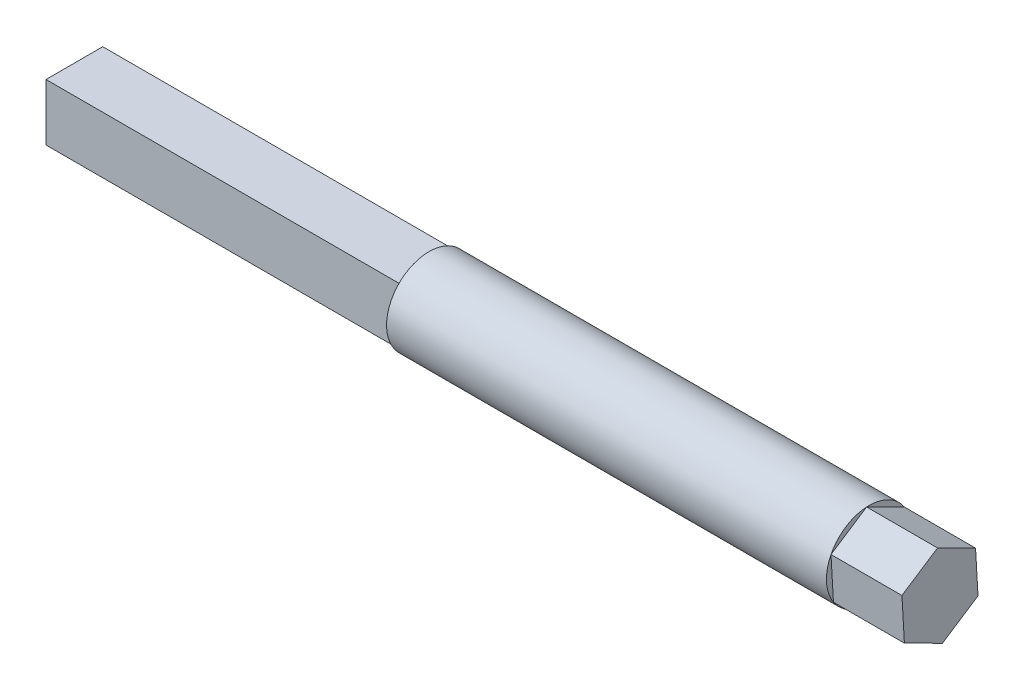
from build123d import *

# Parameters (mm, degrees)
SKETCH3_R           = 3
BOSS_EXTRUDE1_DEPTH = 31
BOSS_EXTRUDE4_DEPTH = 5
SKETCH18_W          = 4
SKETCH18_H          = 4
BOSS_EXTRUDE5_DEPTH = 30
SKETCH21_W          = 4
SKETCH21_H          = 4
CUT_EXTRUDE1_DEPTH  = 5


with BuildPart() as part:
    # Sketch1 → Loft1 section 0
    with BuildSketch(Plane(origin=(0, 0, 0), x_dir=(0, 0, -1), z_dir=(1, 0, 0))):
        with BuildLine():
            Line((-1, -1), (1, -1))
            Line((1, -1), (1, 1))
            Line((1, 1), (-1, 1))
            Line((-1, 1), (-1, -1))
        make_face()
    # Sketch2 → Loft1 section 1
    with BuildSketch(Plane(origin=(30, 0, 0), x_dir=(0, 0, -1), z_dir=(1, 0, 0))):
        with BuildLine():
            Line((-1, -1), (1, -1))
            Line((1, -1), (1, 1))
            Line((1, 1), (-1, 1))
            Line((-1, 1), (-1, -1))
        make_face()
    loft()

    # Sketch3 → Boss-Extrude1 (add)
    with BuildSketch(Plane(origin=(30, 0, 0), x_dir=(0, 0, -1), z_dir=(1, 0, 0))):
        Circle(SKETCH3_R)
    extrude(amount=BOSS_EXTRUDE1_DEPTH)

    # Sketch17 → Boss-Extrude4 (add)
    with BuildSketch(Plane(origin=(61, 0, 0), x_dir=(0, 0, -1), z_dir=(1, 0, 0))):
        Polygon((2.507905391, 1.646332454), (-0.171813033, 2.995076006), (-2.679718424, 1.348743552), (-2.507905391, -1.646332454), (0.171813033, -2.995076006), (2.679718424, -1.348743552), align=None)
    extrude(amount=BOSS_EXTRUDE4_DEPTH)

    # Sketch18 → Boss-Extrude5 (add)
    with BuildSketch(Plane.ZY):
        Rectangle(SKETCH18_W, SKETCH18_H)
    extrude(amount=-BOSS_EXTRUDE5_DEPTH)

    # Sketch21 → Cut-Extrude1 (cut)
    with BuildSketch(Plane.ZY):
        Rectangle(SKETCH21_W, SKETCH21_H)
    extrude(amount=-CUT_EXTRUDE1_DEPTH, mode=Mode.SUBTRACT)


solid = part.part
